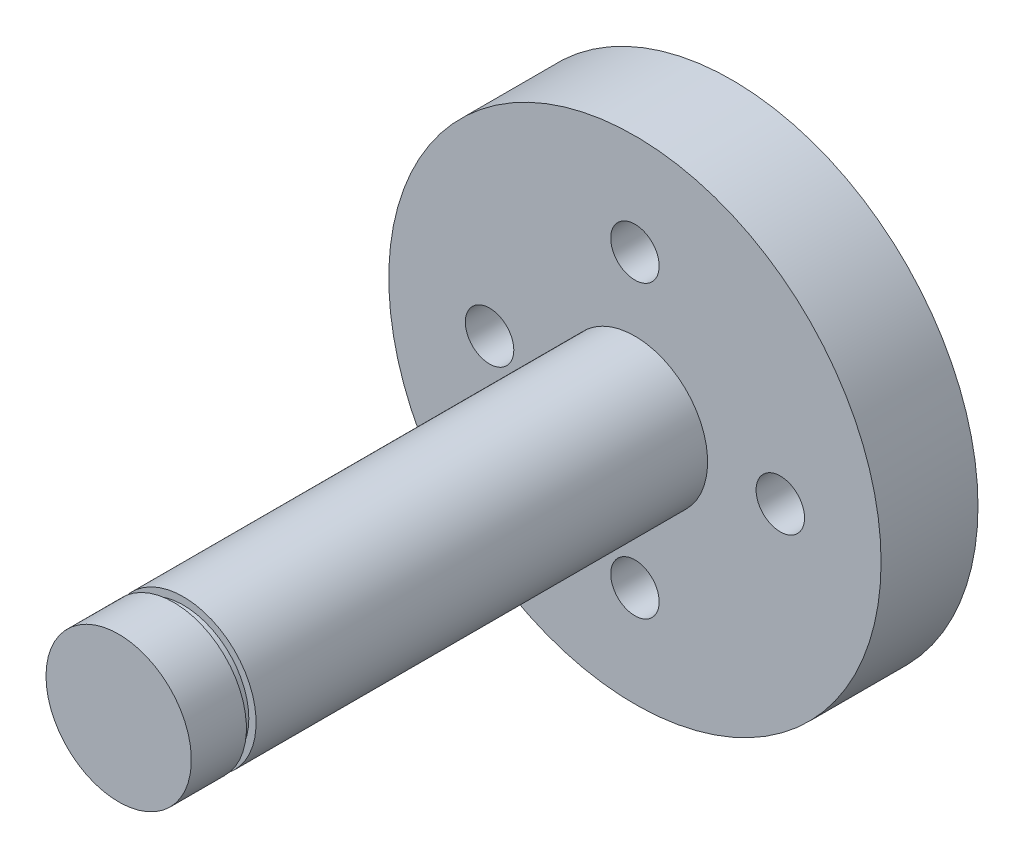
from build123d import *

# Parameters (mm, degrees)
SKETCH1_R                   = 25.4
BOSS_EXTRUDE1_DEPTH         = 10
TAP_DRILL_FOR_M6X1_0_TAP1_D = 5
CIRPATTERN1_COUNT           = 4
SKETCH3_R                   = 7.5
BOSS_EXTRUDE2_DEPTH         = 53.27
SKETCH12_W                  = 1.5
SKETCH12_H                  = 1


with BuildPart() as part:
    # Sketch1 → Boss-Extrude1 (new body)
    with BuildSketch(Plane.XY):
        Circle(SKETCH1_R)
    extrude(amount=BOSS_EXTRUDE1_DEPTH)

    # Tap Drill for M6x1.0 Tap1 (through all)
    with Locations(Plane.XY.offset(10)):
        with Locations((0, 15)):
            tap_drill_for_m6x1_0_tap1 = Hole(TAP_DRILL_FOR_M6X1_0_TAP1_D / 2)

    # CirPattern1: Tap Drill for M6x1.0 Tap1 ×4 about axis
    cirpattern1_axis = Axis((0, 0, 0), (0, 0, 1))
    for i in range(1, CIRPATTERN1_COUNT):
        add(tap_drill_for_m6x1_0_tap1.rotate(cirpattern1_axis, i * 360 / CIRPATTERN1_COUNT), mode=Mode.SUBTRACT)

    # Sketch3 → Boss-Extrude2 (add)
    with BuildSketch(Plane.XY.offset(10)):
        with Locations(Location((0, 0, 0), (0, 0, 180))):
            Circle(SKETCH3_R)
    extrude(amount=BOSS_EXTRUDE2_DEPTH)

    # Sketch12 → Cut-Revolve2 (revolve, cut)
    with BuildSketch(Plane(origin=(0, 0, 0), x_dir=(1, 0, 0), z_dir=(0, 1, 0))):
        with Locations((-7.5, -57.09)):
            Rectangle(SKETCH12_W, SKETCH12_H)
    revolve(axis=Axis((0, 0, 63.27), (0, 0, -1)), mode=Mode.SUBTRACT)


solid = part.part
